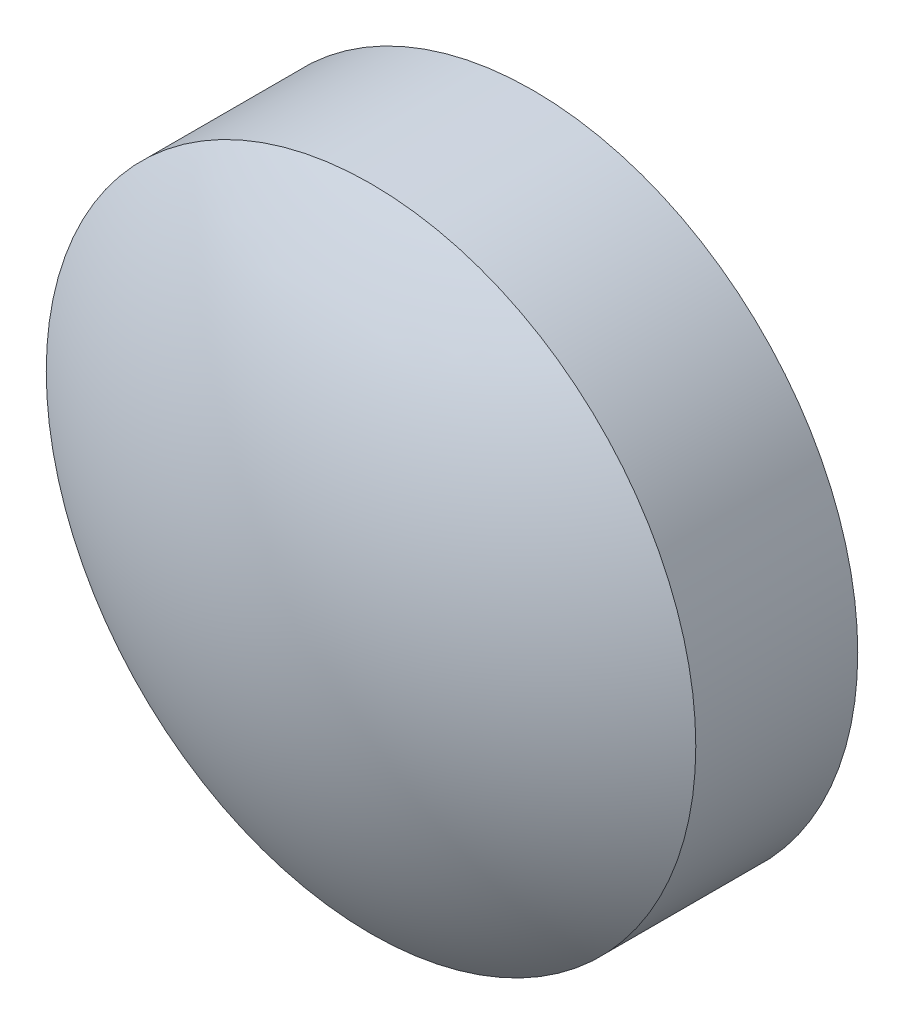
from build123d import *


with BuildPart() as part:
    # Skizze1 → Rotation1 (revolve)
    with BuildSketch(Plane(origin=(0, 0, 0), x_dir=(1, 0, 0), z_dir=(0, 1, 0))):
        with BuildLine():
            Line((3, 1.23), (0, 1.23))
            Line((0, 1.23), (0, -1.23))
            ThreePointArc((0, -1.23), (1.575541027, -0.983077653), (3, -0.265988533))
            Line((3, -0.265988533), (3, 1.23))
        make_face()
    revolve(axis=Axis((0, 0, -1.23), (0, 0, 1)))


solid = part.part
